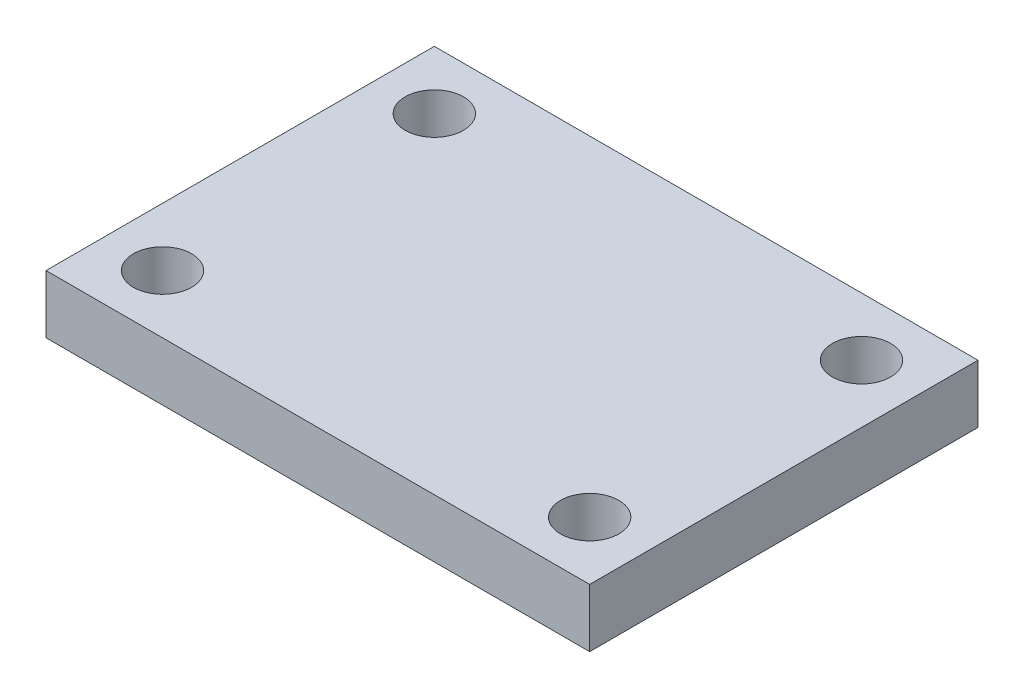
from build123d import *

# Parameters (mm, degrees)
SKETCH1_W           = 28
SKETCH1_H           = 20
SKETCH1_R           = 1.5
BOSS_EXTRUDE1_DEPTH = 3


with BuildPart() as part:
    # Sketch1 → Boss-Extrude1 (new body)
    with BuildSketch(Plane(origin=(0, 0, 0), x_dir=(1, 0, 0), z_dir=(0, 1, 0))):
        Rectangle(SKETCH1_W, SKETCH1_H)
        with Locations(Location((-11, 7, 0), (0, 0, 270))):
            Circle(SKETCH1_R, mode=Mode.SUBTRACT)
        with Locations(Location((-11, -7, 0), (0, 0, 270))):
            Circle(SKETCH1_R, mode=Mode.SUBTRACT)
        with Locations(Location((11, -7, 0), (0, 0, 90))):
            Circle(SKETCH1_R, mode=Mode.SUBTRACT)
        with Locations(Location((11, 7, 0), (0, 0, 90))):
            Circle(SKETCH1_R, mode=Mode.SUBTRACT)
    extrude(amount=BOSS_EXTRUDE1_DEPTH)


solid = part.part
